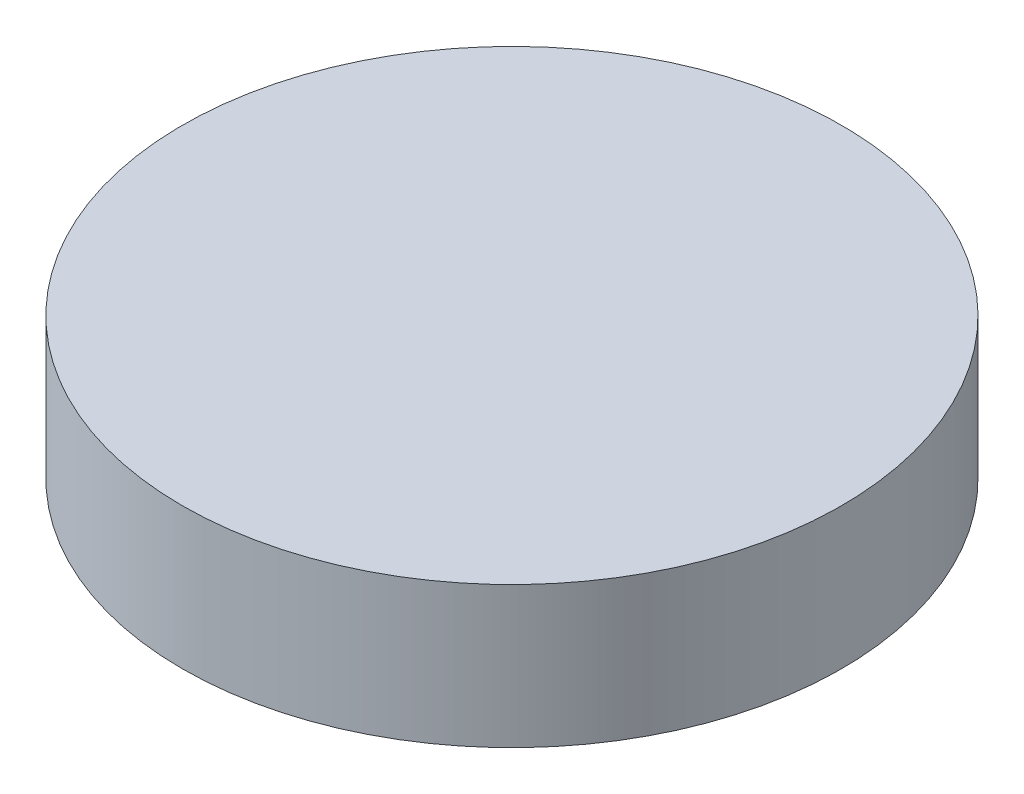
from build123d import *

# Parameters (mm, degrees)
SKETCH1_R           = 14
BOSS_EXTRUDE1_DEPTH = 6
SKETCH2_R           = 2.5
CUT_EXTRUDE1_DEPTH  = 2.4
CUT_EXTRUDE1_TAPER  = 45


with BuildPart() as part:
    # Sketch1 → Boss-Extrude1 (new body)
    with BuildSketch(Plane(origin=(0, 0, 0), x_dir=(1, 0, 0), z_dir=(0, 1, 0))):
        with Locations(Location((0, 0, 0), (0, 0, 270))):
            Circle(SKETCH1_R)
    extrude(amount=BOSS_EXTRUDE1_DEPTH)

    # Sketch2 → Cut-Extrude1 (cut)
    with BuildSketch(Plane(origin=(0, 0, 0), x_dir=(1, 0, 0), z_dir=(0, 1, 0))):
        Circle(SKETCH2_R)
    extrude(amount=CUT_EXTRUDE1_DEPTH, taper=CUT_EXTRUDE1_TAPER, mode=Mode.SUBTRACT)


solid = part.part
